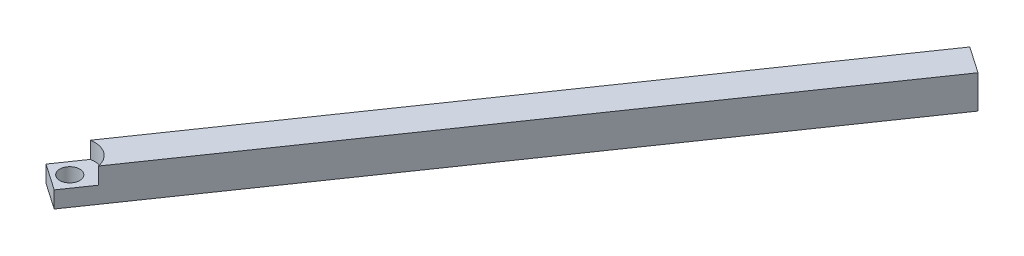
from build123d import *

# Parameters (mm, degrees)
SKETCH1_R           = 1.499690954
BOSS_EXTRUDE2_DEPTH = 5
CUT_EXTRUDE3_DEPTH  = 2.5


with BuildPart() as part:
    # Sketch1 → Boss-Extrude2 (new body)
    with BuildSketch(Plane(origin=(0, 0, 0), x_dir=(1, 0, 0), z_dir=(0, 1, 0))):
        Polygon((0, 0), (56.773285815, 82.321285326), (60.754153273, 79.57586019), (3.980867458, -2.745425136), align=None)
        with Locations(Location((3.182714522, 0.391186569, 0), (0, 0, 270))):
            Circle(SKETCH1_R, mode=Mode.SUBTRACT)
    extrude(amount=BOSS_EXTRUDE2_DEPTH)

    # Sketch2 → Cut-Extrude3 (cut)
    with BuildSketch(Plane(origin=(0, 5, 0), x_dir=(1, 0, 0), z_dir=(0, 1, 0))):
        with BuildLine():
            Line((6.700962503, 1.19871368), (3.980867458, -2.745425136))
            Line((3.980867458, -2.745425136), (0, 0))
            Line((0, 0), (2.720095045, 3.944138817))
            ThreePointArc((2.720095045, 3.944138817), (5.279124937, 3.395890894), (6.700962503, 1.19871368))
        make_face()
    extrude(amount=-CUT_EXTRUDE3_DEPTH, mode=Mode.SUBTRACT)


solid = part.part
